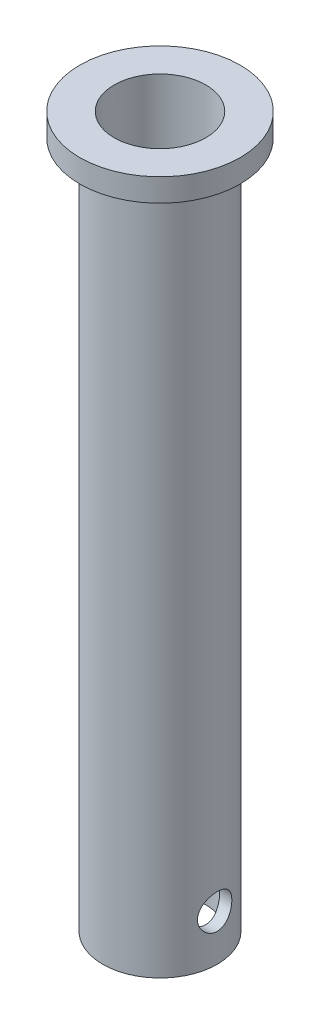
from build123d import *

# Parameters (mm, degrees)
SKETCH1_R               = 35
SKETCH1_R_2             = 20
BOSS_EXTRUDE1_DEPTH     = 10
BOSS_EXTRUDE4_START     = -300
SKETCH1_6_R             = 25
SKETCH1_6_R_2           = 20
BOSS_EXTRUDE4_DEPTH     = 300
CUT_EXTRUDE2_DEPTH      = 305.05591591
CUT_EXTRUDE2_DEPTH_BACK = 305.05591591
SKETCH2_R               = 7.5


with BuildPart() as part:
    # Sketch1 → Boss-Extrude1 (new body)
    with BuildSketch(Plane(origin=(0, 0, 0), x_dir=(1, 0, 0), z_dir=(0, 1, 0))):
        Circle(SKETCH1_R)
        Circle(SKETCH1_R_2, mode=Mode.SUBTRACT)
    extrude(amount=BOSS_EXTRUDE1_DEPTH)

    # Sketch1<6> → Boss-Extrude4 (add)
    with BuildSketch(Plane(origin=(0, 0, 0), x_dir=(1, 0, 0), z_dir=(0, 1, 0)).offset(BOSS_EXTRUDE4_START)):
        Circle(SKETCH1_6_R)
        Circle(SKETCH1_6_R_2, mode=Mode.SUBTRACT)
    extrude(amount=BOSS_EXTRUDE4_DEPTH)

    # Sketch2 → Cut-Extrude2 (cut, two sides: drawn at the far end of the back side and taken through both)
    with BuildSketch(Plane(origin=(0, 0, 0), x_dir=(0, 0, -1), z_dir=(1, 0, 0)).offset(-CUT_EXTRUDE2_DEPTH_BACK)):
        with Locations((0, -280)):
            Circle(SKETCH2_R)
    extrude(amount=CUT_EXTRUDE2_DEPTH + CUT_EXTRUDE2_DEPTH_BACK, mode=Mode.SUBTRACT)


solid = part.part
